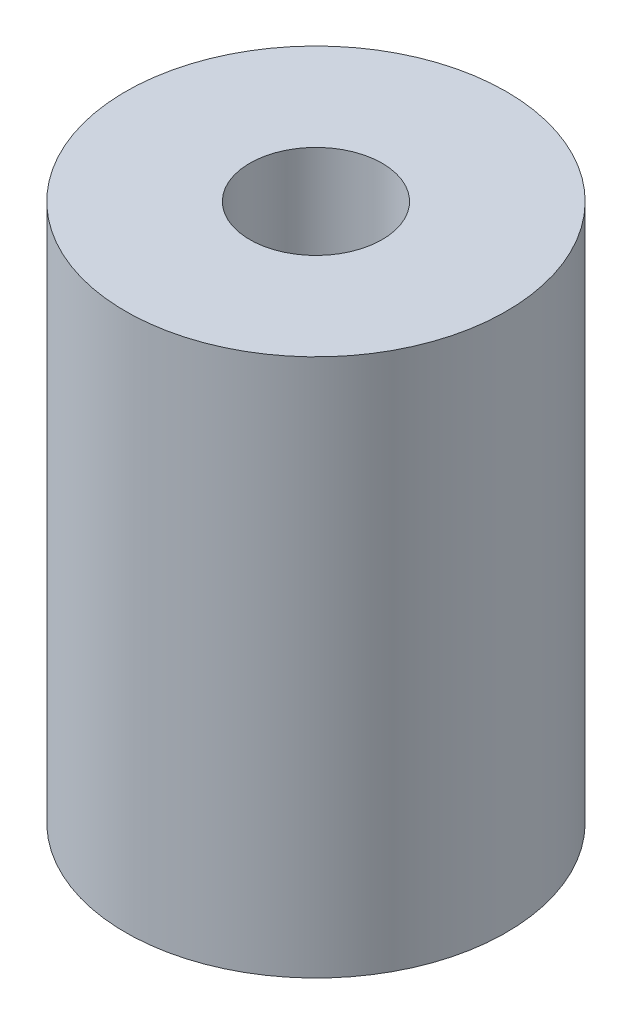
from build123d import *

# Parameters (mm, degrees)
SKETCH1_R           = 4.6
SKETCH1_R_2         = 1.6
BOSS_EXTRUDE1_DEPTH = 13


with BuildPart() as part:
    # Sketch1 → Boss-Extrude1 (new body)
    with BuildSketch(Plane(origin=(0, 0, 0), x_dir=(1, 0, 0), z_dir=(0, 1, 0))):
        with Locations(Location((0, 0, 0), (0, 0, 90))):
            Circle(SKETCH1_R)
        with Locations(Location((0, 0, 0), (0, 0, 90))):
            Circle(SKETCH1_R_2, mode=Mode.SUBTRACT)
    extrude(amount=BOSS_EXTRUDE1_DEPTH)


solid = part.part
